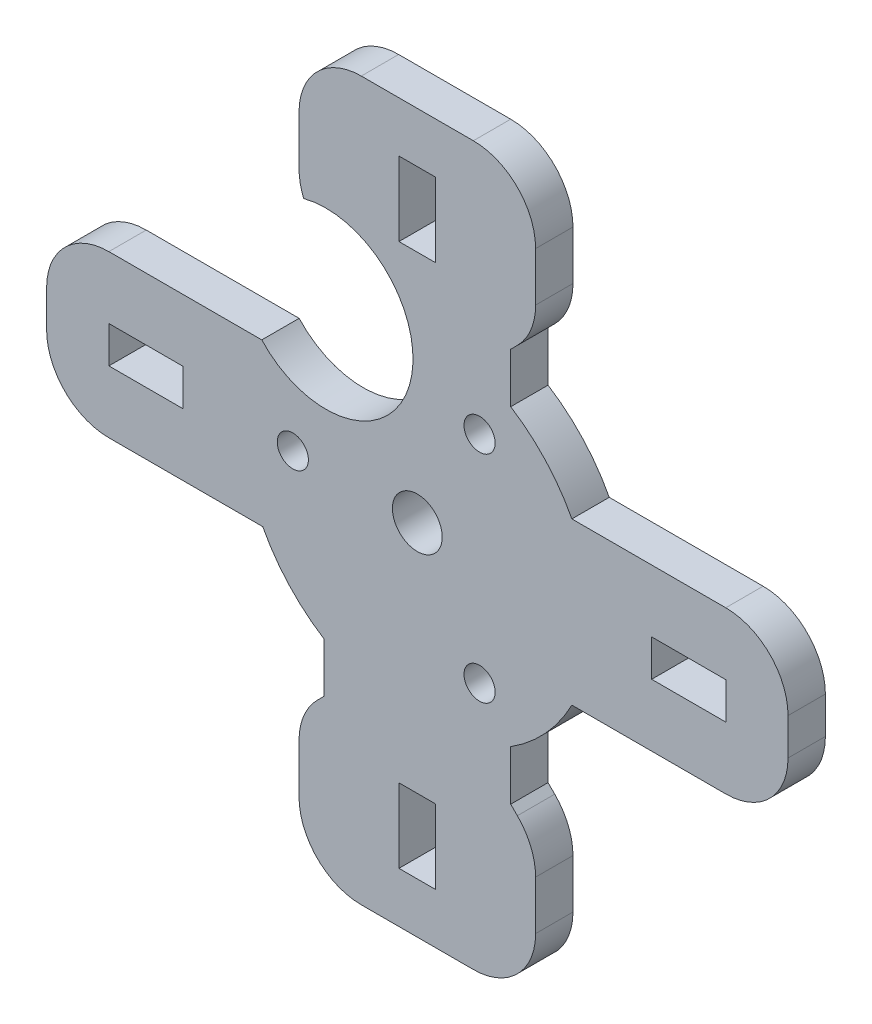
from build123d import *

# Parameters (mm, degrees)
SKETCH1_R           = 1.25
BOSS_EXTRUDE1_DEPTH = 3
SKETCH2_W           = 19
SKETCH2_H           = 10
BOSS_EXTRUDE2_DEPTH = 3
SKETCH3_R           = 2
CUT_EXTRUDE1_DEPTH  = 10
SKETCH4_W           = 2.95
SKETCH4_H           = 5.95
CUT_EXTRUDE2_DEPTH  = 33.182045836
FILLET1_R           = 5
SKETCH5_W           = 5.95
SKETCH5_H           = 2.95
BOSS_EXTRUDE3_DEPTH = 3
FILLET2_R           = 5
SKETCH6_R           = 7
CUT_EXTRUDE4_DEPTH  = 10


with BuildPart() as part:
    # Sketch1 → Boss-Extrude1 (new body)
    with BuildSketch(Plane.XY):
        with BuildLine():
            Line((7.5, 18.821590418), (9.5, 18.821590418))
            Line((9.5, 18.821590418), (9.5, 17.821590418))
            Line((9.5, 17.821590418), (7.5, 15.821590418))
            Line((7.5, 15.821590418), (7.5, 11.821590418))
            ThreePointArc((7.5, 11.821590418), (14, 0), (7.5, -11.821590418))
            Line((7.5, -11.821590418), (7.5, -15.821590418))
            Line((7.5, -15.821590418), (9.5, -17.821590418))
            Line((9.5, -17.821590418), (9.5, -18.821590418))
            Line((9.5, -18.821590418), (7.5, -18.821590418))
            Line((7.5, -18.821590418), (-7.5, -18.821590418))
            Line((-7.5, -18.821590418), (-9.5, -18.821590418))
            Line((-9.5, -18.821590418), (-9.5, -17.821590418))
            Line((-9.5, -17.821590418), (-7.5, -15.821590418))
            Line((-7.5, -15.821590418), (-7.5, -11.821590418))
            ThreePointArc((-7.5, -11.821590418), (-14, 0), (-7.5, 11.821590418))
            Line((-7.5, 11.821590418), (-7.5, 15.821590418))
            Line((-7.5, 15.821590418), (-9.5, 17.821590418))
            Line((-9.5, 17.821590418), (-9.5, 18.821590418))
            Line((-9.5, 18.821590418), (-7.5, 18.821590418))
            Line((-7.5, 18.821590418), (7.5, 18.821590418))
        make_face()
        with Locations((-10, 0)):
            Circle(SKETCH1_R, mode=Mode.SUBTRACT)
        with Locations((5, 8.660254038)):
            Circle(SKETCH1_R, mode=Mode.SUBTRACT)
        with Locations((5, -8.660254038)):
            Circle(SKETCH1_R, mode=Mode.SUBTRACT)
    extrude(amount=BOSS_EXTRUDE1_DEPTH)

    # Sketch2 → Boss-Extrude2 (add)
    with BuildSketch(Plane(origin=(0, 0, 0), x_dir=(-1, 0, 0), z_dir=(0, 0, -1))):
        with Locations((0, 23.821590418)):
            Rectangle(SKETCH2_W, SKETCH2_H)
        with Locations((0, -23.821590418)):
            Rectangle(SKETCH2_W, SKETCH2_H)
    extrude(amount=-BOSS_EXTRUDE2_DEPTH)

    # Sketch3 → Cut-Extrude1 (cut)
    with BuildSketch(Plane(origin=(0, 0, 0), x_dir=(-1, 0, 0), z_dir=(0, 0, -1))):
        Circle(SKETCH3_R)
    extrude(amount=-CUT_EXTRUDE1_DEPTH, mode=Mode.SUBTRACT)

    # Sketch4 → Cut-Extrude2 (cut, through all)
    with BuildSketch(Plane(origin=(0, 0, 0), x_dir=(-1, 0, 0), z_dir=(0, 0, -1))):
        with Locations((0, 21.796590418)):
            Rectangle(SKETCH4_W, SKETCH4_H)
        with Locations((0, -21.796590418)):
            Rectangle(SKETCH4_W, SKETCH4_H)
    extrude(amount=-CUT_EXTRUDE2_DEPTH, mode=Mode.SUBTRACT)

    # Fillet1
    fillet1_edges = [part.edges().sort_by_distance(p)[0] for p in [
        (9.5, -17.821590418, 1.5),
        (-9.5, -17.821590418, 1.5),
        (-9.5, 17.821590418, 1.5),
        (9.5, 17.821590418, 1.5),
        (-9.5, 28.821590418, 1.5),
        (9.5, 28.821590418, 1.5),
        (-9.5, -28.821590418, 1.5),
        (9.5, -28.821590418, 1.5),
    ]]
    fillet(fillet1_edges, radius=FILLET1_R)

    # Sketch5 → Boss-Extrude3 (add)
    # profile 1 of 2: a face of its own
    with BuildSketch(Plane(origin=(0, 0, 0), x_dir=(-1, 0, 0), z_dir=(0, 0, -1))):
        with BuildLine():
            Line((-12.412669938, -6.475), (-29.771590418, -6.475))
            Line((-29.771590418, -6.475), (-29.771590418, 6.475))
            Line((-29.771590418, 6.475), (-12.412669938, 6.475))
            ThreePointArc((-12.412669938, 6.475), (-14, 0), (-12.412669938, -6.475))
        make_face()
        with Locations((-21.796590418, 0)):
            Rectangle(SKETCH5_W, SKETCH5_H, mode=Mode.SUBTRACT)
    # profile 2 of 2: a face of its own
    with BuildSketch(Plane(origin=(0, 0, 0), x_dir=(-1, 0, 0), z_dir=(0, 0, -1))):
        with BuildLine():
            Line((29.771590418, 6.475), (12.412669938, 6.475))
            ThreePointArc((12.412669938, 6.475), (14, 0), (12.412669938, -6.475))
            Line((12.412669938, -6.475), (29.771590418, -6.475))
            Line((29.771590418, -6.475), (29.771590418, 6.475))
        make_face()
        with Locations((21.796590418, 0)):
            Rectangle(SKETCH5_W, SKETCH5_H, mode=Mode.SUBTRACT)
    extrude(amount=-BOSS_EXTRUDE3_DEPTH)

    # Fillet2
    fillet2_edges = [part.edges().sort_by_distance(p)[0] for p in [
        (-29.771590418, 6.475, 1.5),
        (-29.771590418, -6.475, 1.5),
        (29.771590418, -6.475, 1.5),
        (29.771590418, 6.475, 1.5),
    ]]
    fillet(fillet2_edges, radius=FILLET2_R)

    # Sketch6 → Cut-Extrude4 (cut)
    with BuildSketch(Plane.XY.offset(3)):
        with Locations((-7.346152109, 11.220655855)):
            Circle(SKETCH6_R)
    extrude(amount=-CUT_EXTRUDE4_DEPTH, mode=Mode.SUBTRACT)


solid = part.part
